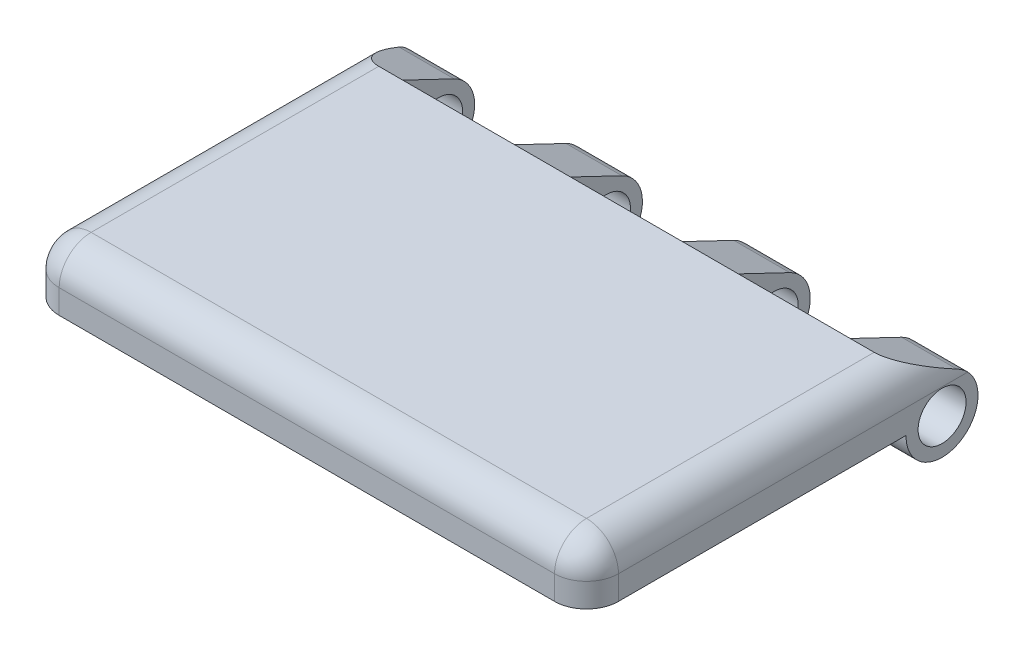
from build123d import *

# Parameters (mm, degrees)
SKETCH1_W           = 35
SKETCH1_H           = 20
BOSS_EXTRUDE1_DEPTH = 3.5
SKETCH3_R           = 1.5
BOSS_EXTRUDE2_DEPTH = 3.5
LPATTERN1_COUNT     = 4
LPATTERN1_PITCH     = 10.5
FILLET1_R           = 2


with BuildPart() as part:
    # Sketch1 → Boss-Extrude1 (new body)
    with BuildSketch(Plane(origin=(0, 0, 0), x_dir=(1, 0, 0), z_dir=(0, 1, 0))):
        Rectangle(SKETCH1_W, SKETCH1_H)
    extrude(amount=BOSS_EXTRUDE1_DEPTH)

    # Sketch3 → Boss-Extrude2 (add)
    with BuildSketch(Plane(origin=(17.5, 0, 0), x_dir=(0, 0, -1), z_dir=(1, 0, 0))):
        with BuildLine():
            ThreePointArc((13.220333212, 1.958519537), (13.418028169, -1.993351189), (10, 0))
            Line((10, 0), (10, 3.5))
            Line((10, 3.5), (13.220333212, 1.958519537))
        make_face()
        with Locations((12.248880815, -0.070958288)):
            Circle(SKETCH3_R, mode=Mode.SUBTRACT)
    boss_extrude2 = extrude(amount=-BOSS_EXTRUDE2_DEPTH)

    # LPattern1: Boss-Extrude2 ×4
    with Locations(*[(-i * LPATTERN1_PITCH, 0, 0) for i in range(1, LPATTERN1_COUNT)]):
        add(boss_extrude2)

    # Fillet1
    fillet1_edges = [part.edges().sort_by_distance(p)[0] for p in [
        (17.5, 3.5, 0),
        (0, 3.5, 10),
        (-17.5, 3.5, 0),
        (-17.5, 1.75, 10),
        (17.5, 1.75, 10),
    ]]
    fillet(fillet1_edges, radius=FILLET1_R)


solid = part.part
